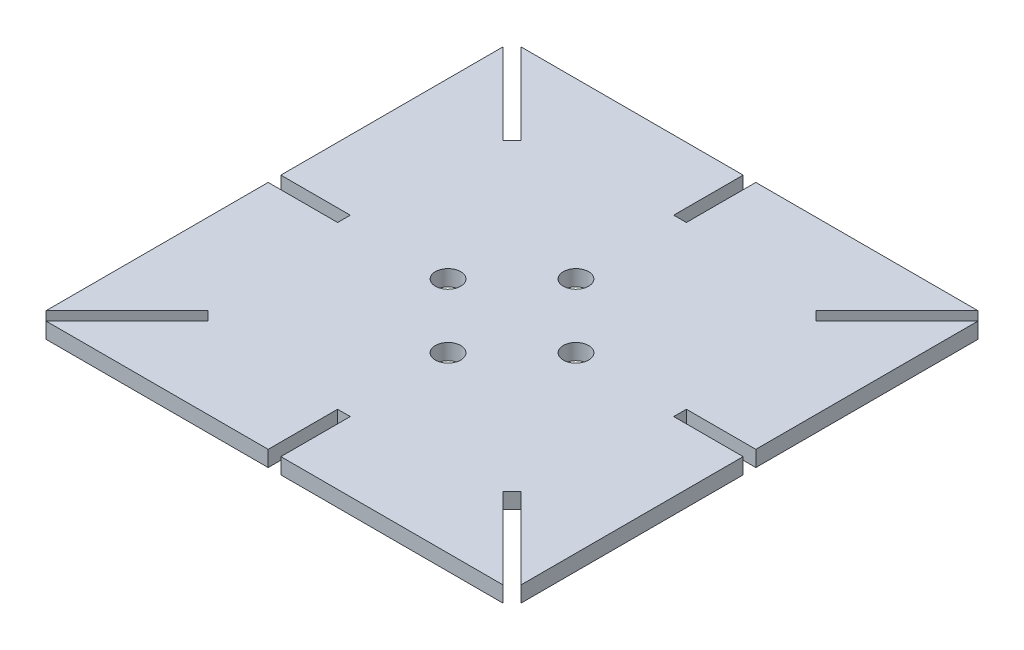
from build123d import *

# Parameters (mm, degrees)
SKETCH_1_R      = 1.6
EXTRUDE_1_DEPTH = 2


with BuildPart() as part:
    # 草图1 → 凸台-拉伸1 (new body)
    with BuildSketch(Plane(origin=(0, 0, 0), x_dir=(1, 0, 0), z_dir=(0, 1, 0))):
        Polygon((-30, 28.86862915), (-30, 0.8), (-21.23, 0.8), (-21.23, -0.8), (-30, -0.8), (-30, -28.86862915), (-19.758831067, -18.627460217), (-18.627460217, -19.758831067), (-28.86862915, -30), (-0.8, -30), (-0.8, -21.23), (0.8, -21.23), (0.8, -30), (28.86862915, -30), (18.627460217, -19.758831067), (19.758831067, -18.627460217), (30, -28.86862915), (30, -0.8), (21.23, -0.8), (21.23, 0.8), (30, 0.8), (30, 28.86862915), (19.758831067, 18.627460217), (18.627460217, 19.758831067), (28.86862915, 30), (0.8, 30), (0.8, 21.23), (-0.8, 21.23), (-0.8, 30), (-28.86862915, 30), (-18.627460217, 19.758831067), (-19.758831067, 18.627460217), align=None)
        with Locations(Location((0, -8.08, 0), (0, 0, 270))):
            Circle(SKETCH_1_R, mode=Mode.SUBTRACT)
        with Locations(Location((-8.08, 0, 0), (0, 0, 270))):
            Circle(SKETCH_1_R, mode=Mode.SUBTRACT)
        with Locations(Location((8.08, 0, 0), (0, 0, 270))):
            Circle(SKETCH_1_R, mode=Mode.SUBTRACT)
        with Locations(Location((0, 8.08, 0), (0, 0, 270))):
            Circle(SKETCH_1_R, mode=Mode.SUBTRACT)
    extrude(amount=EXTRUDE_1_DEPTH)


solid = part.part
